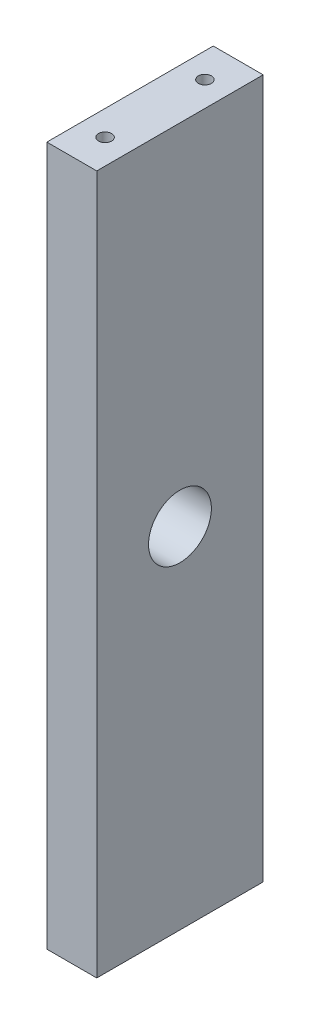
from build123d import *

# Parameters (mm, degrees)
SKETCH1_W                      = 31.75
SKETCH1_H                      = 133.35
BOSS_EXTRUDE1_DEPTH            = 4.7625
M3X0_5_TAPPED_HOLE1_AT_2_COUNT = 2
M3X0_5_TAPPED_HOLE1_AT_2_PITCH = 19.05
F_12_0MM_DOWEL_HOLE1_D         = 12


with BuildPart() as part:
    # Sketch1 → Boss-Extrude1 (new, symmetric)
    with BuildSketch(Plane(origin=(0, 0, 0), x_dir=(0, 0, -1), z_dir=(1, 0, 0))):
        Rectangle(SKETCH1_W, SKETCH1_H)
    extrude(amount=BOSS_EXTRUDE1_DEPTH, both=True)

    # Sketch4 → M3x0.5 Tapped Hole1 (revolve, cut)
    with BuildSketch(Plane(origin=(0, 66.675, -9.525), x_dir=(0, 0, 1), z_dir=(1, 0, 0))):
        Polygon((0, 0), (0, 13.451075774), (1.25, 12.7), (1.25, 0), align=None)
    m3x0_5_tapped_hole1 = revolve(axis=Axis((0, 73.025, -9.525), (0, -1, 0)), mode=Mode.SUBTRACT)

    # M3x0.5 Tapped Hole1 at 2: M3x0.5 Tapped Hole1 ×2
    with Locations(*[(0, 0, i * M3X0_5_TAPPED_HOLE1_AT_2_PITCH) for i in range(1, M3X0_5_TAPPED_HOLE1_AT_2_COUNT)]):
        add(m3x0_5_tapped_hole1, mode=Mode.SUBTRACT)

    # Mirror1: M3x0.5 Tapped Hole1 across plane
    add(m3x0_5_tapped_hole1.mirror(Plane.ZX), mode=Mode.SUBTRACT)

    # Mirror1 copy 1 sketch → Mirror1 copy 1 (revolve, cut)
    with BuildSketch(Plane(origin=(0, -66.675, 9.525), x_dir=(0, 0, 1), z_dir=(1, 0, 0))):
        Polygon((0, 0), (0, -13.451075774), (1.25, -12.7), (1.25, 0), align=None)
    revolve(axis=Axis((0, -73.025, 9.525), (0, -1, 0)), mode=Mode.SUBTRACT)

    # Ø12.0mm Dowel Hole1 (through all)
    with Locations(Plane(origin=(4.7625, 0, 0), x_dir=(0, 0, -1), z_dir=(1, 0, 0))):
        with Locations((0, 0)):
            Hole(F_12_0MM_DOWEL_HOLE1_D / 2)


solid = part.part
